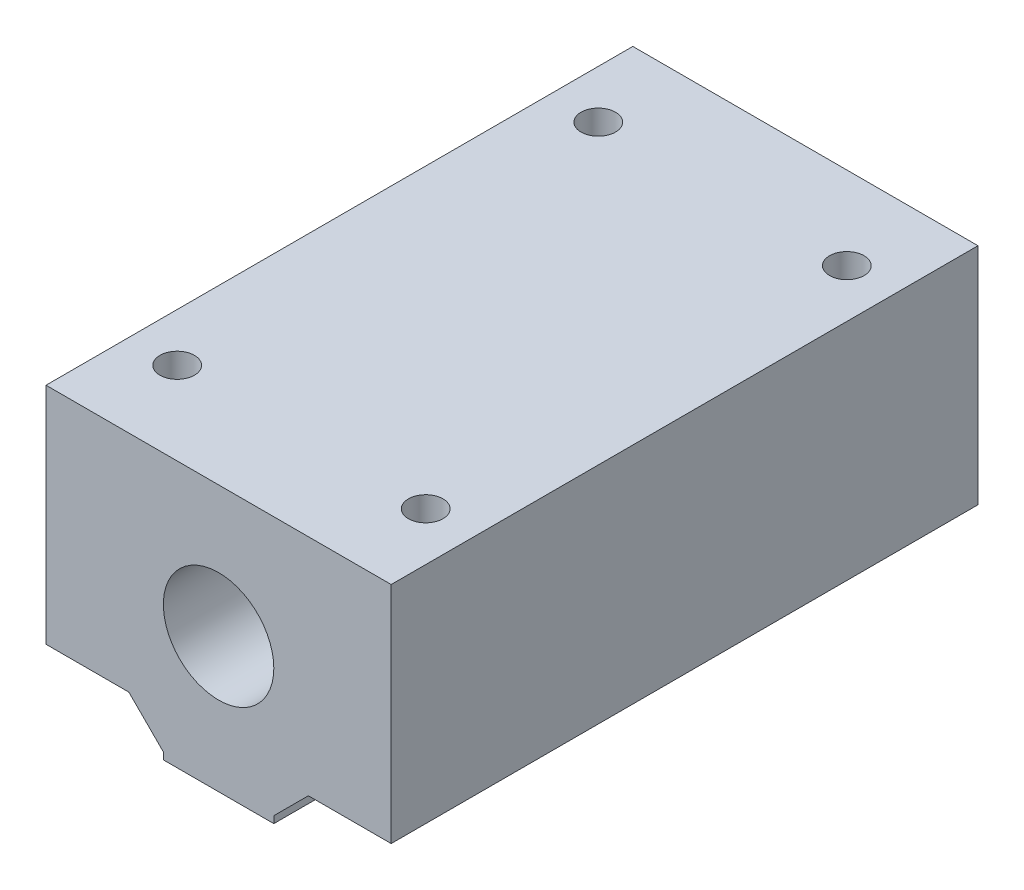
from build123d import *

# Parameters (mm, degrees)
SKETCH_1_R          = 8
EXTRUDE_1_DEPTH     = 85
SKETCH_2_R          = 2.5
CUT_EXTRUDE_1_DEPTH = 97.603571363


with BuildPart() as part:
    # 草图1 → 凸台-拉伸1 (new body)
    with BuildSketch(Plane.XY):
        Polygon((8, 0), (-8, 0), (-8, 1), (-13, 6), (-25, 6), (-25, 38.5), (25, 38.5), (25, 6), (13, 6), (8, 1), align=None)
        with Locations((0, 19.5)):
            Circle(SKETCH_1_R, mode=Mode.SUBTRACT)
    extrude(amount=EXTRUDE_1_DEPTH)

    # 草图2 → 切除-拉伸1 (cut, through all)
    with BuildSketch(Plane(origin=(0, 38.5, 0), x_dir=(1, 0, 0), z_dir=(0, 1, 0))):
        with Locations(Location((-18, -12, 0), (0, 0, 270))):
            Circle(SKETCH_2_R)
        with Locations(Location((18, -12, 0), (0, 0, 270))):
            Circle(SKETCH_2_R)
        with Locations(Location((18, -73, 0), (0, 0, 270))):
            Circle(SKETCH_2_R)
        with Locations(Location((-18, -73, 0), (0, 0, 270))):
            Circle(SKETCH_2_R)
    extrude(amount=-CUT_EXTRUDE_1_DEPTH, mode=Mode.SUBTRACT)


solid = part.part
